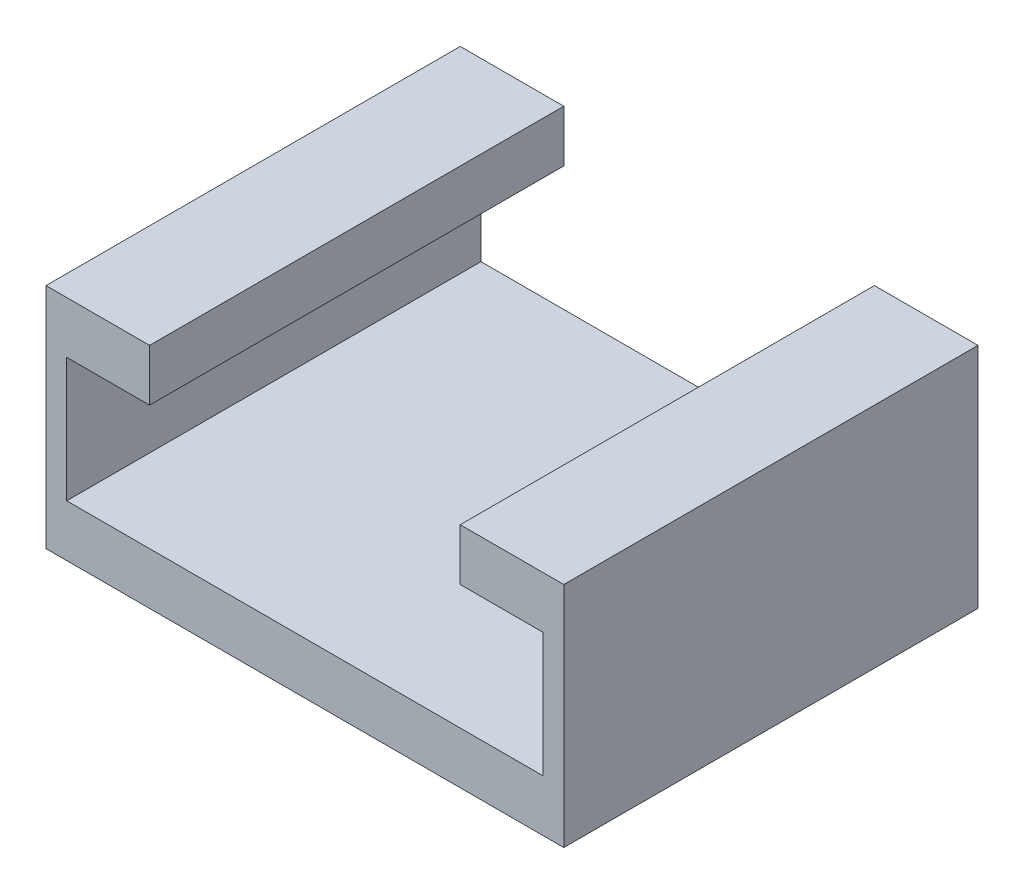
from build123d import *

# Parameters (mm, degrees)
SKETCH1_W                = 50
SKETCH1_H                = 40
BOSS_EXTRUDE2_DEPTH      = 5
SKETCH2_W                = 2
SKETCH2_H                = 40
BOSS_EXTRUDE4_DEPTH      = 12
SKETCH3_W                = 10
SKETCH3_H                = 40
BOSS_EXTRUDE5_DEPTH      = 5
BOSS_EXTRUDE6_DEPTH      = 15
BOSS_EXTRUDE6_DEPTH_BACK = 15
SKETCH5_R                = 1.5


with BuildPart() as part:
    # Sketch1 → Boss-Extrude2 (new body)
    with BuildSketch(Plane(origin=(0, 0, 0), x_dir=(1, 0, 0), z_dir=(0, 1, 0))):
        with Locations((25, 20)):
            Rectangle(SKETCH1_W, SKETCH1_H)
    extrude(amount=BOSS_EXTRUDE2_DEPTH)

    # Sketch2 → Boss-Extrude4 (add)
    with BuildSketch(Plane(origin=(0, 5, 0), x_dir=(1, 0, 0), z_dir=(0, 1, 0))):
        with Locations((1, 20)):
            Rectangle(SKETCH2_W, SKETCH2_H)
        with Locations((49, 20)):
            Rectangle(SKETCH2_W, SKETCH2_H)
    extrude(amount=BOSS_EXTRUDE4_DEPTH)

    # Sketch3 → Boss-Extrude5 (add)
    with BuildSketch(Plane(origin=(0, 17, 0), x_dir=(1, 0, 0), z_dir=(0, 1, 0))):
        with Locations((5, 20)):
            Rectangle(SKETCH3_W, SKETCH3_H)
        with Locations((45, 20)):
            Rectangle(SKETCH3_W, SKETCH3_H)
    extrude(amount=BOSS_EXTRUDE5_DEPTH)

    # Sketch5 → Boss-Extrude6 (add, two sides: drawn at the far end of the back side and taken through both)
    with BuildSketch(Plane(origin=(25, 0, 0), x_dir=(0, 0, -1), z_dir=(1, 0, 0)).offset(-BOSS_EXTRUDE6_DEPTH_BACK)):
        with BuildLine():
            Line((23.5, 0), (23.5, -2.5))
            ThreePointArc((23.5, -2.5), (26, -5), (28.5, -2.5))
            Line((28.5, -2.5), (28.5, 0))
            Line((28.5, 0), (23.5, 0))
        make_face()
        with Locations((26, -2)):
            Circle(SKETCH5_R, mode=Mode.SUBTRACT)
    extrude(amount=BOSS_EXTRUDE6_DEPTH + BOSS_EXTRUDE6_DEPTH_BACK)


solid = part.part
